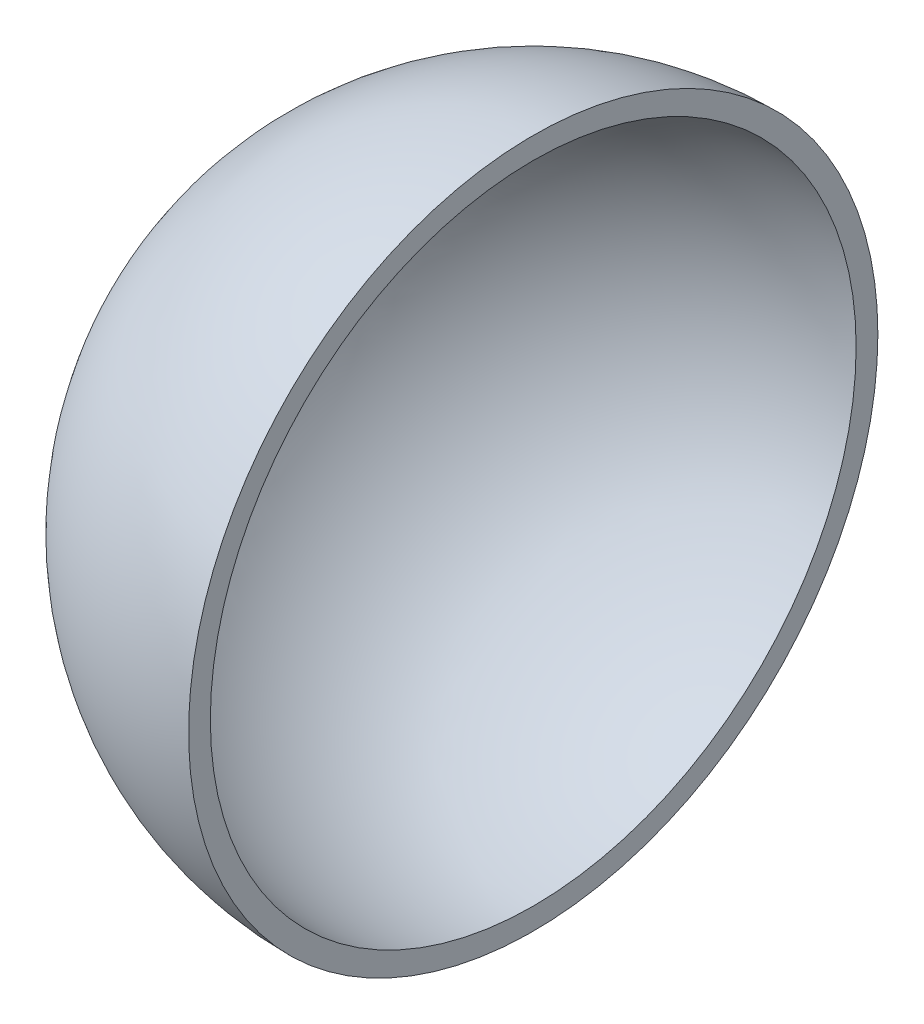
from build123d import *
from build123d.topology import SkipClean

# Parameters (mm, degrees)
CUT_EXTRUDE1_DEPTH      = 1059
CUT_EXTRUDE1_DEPTH_BACK = 900
SKETCH2_W               = 786.886229181
SKETCH2_H               = 1563.628511717


with BuildPart() as part:
    # Sketch1 → Revolve1 (revolve)
    with BuildSketch(Plane.XY):
        with BuildLine():
            Line((-184.933621706, 858.189722625), (-184.933621706, 812.045015021))
            ThreePointArc((-184.933621706, 812.045015021), (-870.167467239, 126.811169487), (-184.933621706, -558.422676046))
            Line((-184.933621706, -558.422676046), (-184.933621706, -604.56738365))
            ThreePointArc((-184.933621706, -604.56738365), (-916.312174843, 126.811169487), (-184.933621706, 858.189722625))
        make_face()
    revolve(axis=Axis((-184.933621706, 858.189722625, 0), (0, -1, 0)))

    # Sketch2 → Cut-Extrude1 (cut, two sides: drawn at the far end of the back side and taken through both)
    with SkipClean():  # the faces are left unmerged after this step: merging them gives an invalid solid
        with BuildSketch(Plane.XY.offset(-CUT_EXTRUDE1_DEPTH_BACK)):
            with Locations((208.509492884, 76.375466766)):
                Rectangle(SKETCH2_W, SKETCH2_H)
        extrude(amount=CUT_EXTRUDE1_DEPTH + CUT_EXTRUDE1_DEPTH_BACK, mode=Mode.SUBTRACT)


solid = part.part
